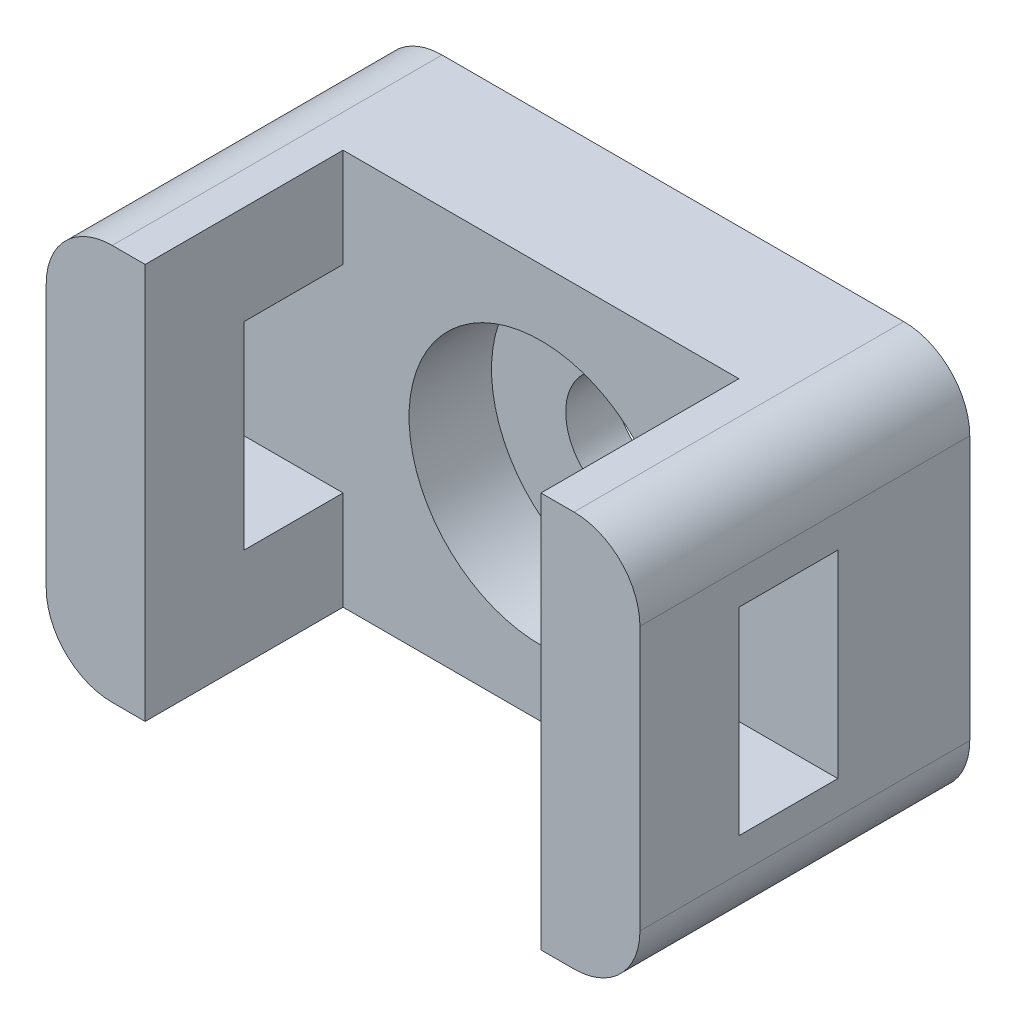
from build123d import *

# Parameters (mm, degrees)
SKETCH1_W           = 18
SKETCH1_H           = 12
BOSS_EXTRUDE1_DEPTH = 4
BOSS_EXTRUDE2_DEPTH = 3
SKETCH3_R           = 1.75
CUT_EXTRUDE1_DEPTH  = 13.369316877
SKETCH4_R           = 4
CUT_EXTRUDE2_DEPTH  = 2.5
FILLET1_R           = 2


with BuildPart() as part:
    # Sketch1 → Boss-Extrude1 (new body)
    with BuildSketch(Plane.XY):
        Rectangle(SKETCH1_W, SKETCH1_H)
    extrude(amount=BOSS_EXTRUDE1_DEPTH)

    # Sketch2 → Boss-Extrude2 (add)
    with BuildSketch(Plane(origin=(9, 0, 0), x_dir=(0, 0, -1), z_dir=(1, 0, 0))):
        Polygon((-4, 6), (-10, 6), (-10, -6), (-4, -6), (-4, -3), (-7, -3), (-7, 3), (-4, 3), align=None)
    boss_extrude2 = extrude(amount=-BOSS_EXTRUDE2_DEPTH)

    # Mirror1: Boss-Extrude2 across plane
    add(boss_extrude2.mirror(Plane(origin=(0, 0, 0), x_dir=(0, 0, 1), z_dir=(1, 0, 0))))

    # Sketch3 → Cut-Extrude1 (cut, through all)
    with BuildSketch(Plane.XY.offset(4)):
        Circle(SKETCH3_R)
    extrude(amount=-CUT_EXTRUDE1_DEPTH, mode=Mode.SUBTRACT)

    # Sketch4 → Cut-Extrude2 (cut)
    with BuildSketch(Plane.XY.offset(4)):
        Circle(SKETCH4_R)
    extrude(amount=-CUT_EXTRUDE2_DEPTH, mode=Mode.SUBTRACT)

    # Fillet1
    fillet1_edges = [part.edges().sort_by_distance(p)[0] for p in [
        (-9, 6, 5),
        (9, 6, 5),
        (9, -6, 5),
        (-9, -6, 5),
    ]]
    fillet(fillet1_edges, radius=FILLET1_R)


solid = part.part
